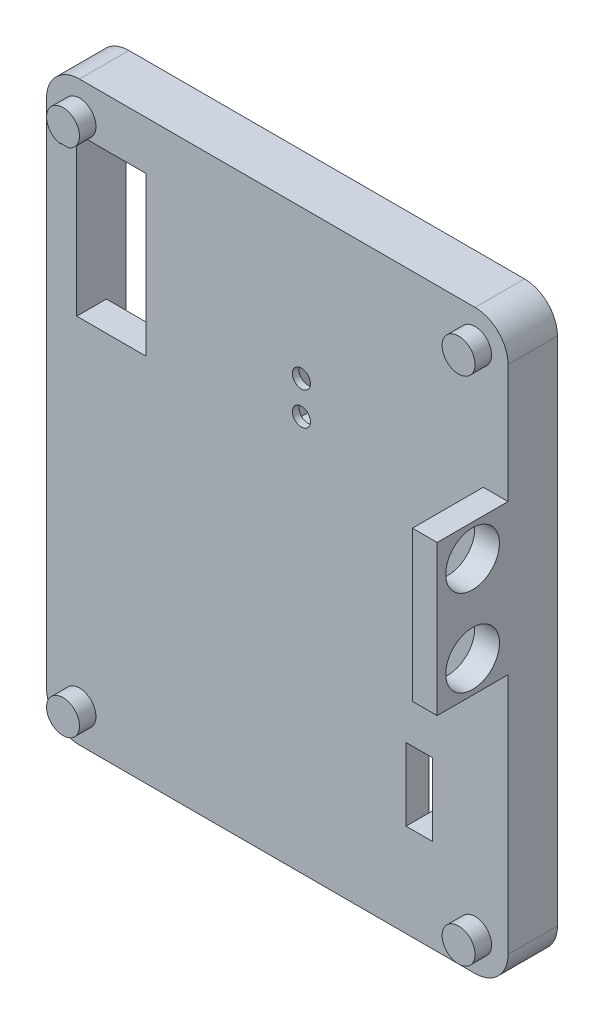
from build123d import *

# Parameters (mm, degrees)
BOSS_EXTRUDE1_DEPTH = 15
SKETCH5_R           = 5
BOSS_EXTRUDE2_DEPTH = 5
SKETCH8_W           = 7.5
SKETCH8_H           = 45.5
CUT_EXTRUDE1_DEPTH  = 7.5
SKETCH9_R           = 8.15
BOSS_EXTRUDE4_DEPTH = 7.5
SKETCH15_W          = 76.4
SKETCH15_H          = 69.2
CUT_EXTRUDE2_DEPTH  = 8
SKETCH16_W          = 5.2
SKETCH16_H          = 22
CUT_EXTRUDE3_DEPTH  = 8
SKETCH20_W          = 8
SKETCH20_H          = 22
CUT_EXTRUDE4_DEPTH  = 10
SKETCH21_W          = 7.307692308
SKETCH21_H          = 1.025641026
CUT_EXTRUDE5_DEPTH  = 3
SKETCH14_W          = 36.6
SKETCH14_H          = 80.6
CUT_EXTRUDE6_DEPTH  = 6
SKETCH22_W          = 21
SKETCH22_H          = 48
CUT_EXTRUDE7_DEPTH  = 15
SKETCH24_W          = 10
SKETCH24_H          = 20
CUT_EXTRUDE8_DEPTH  = 13
SKETCH25_R          = 2.75
CUT_EXTRUDE9_DEPTH  = 10


with BuildPart() as part:
    # Sketch2 → Boss-Extrude1 (new body)
    with BuildSketch(Plane.XY):
        with BuildLine():
            Line((-78.972650771, 68.823281907), (41.027349229, 68.823281907))
            ThreePointArc((41.027349229, 68.823281907), (48.09841704, 65.894349719), (51.027349229, 58.823281907))
            Line((51.027349229, 58.823281907), (51.027349229, -96.176718093))
            ThreePointArc((51.027349229, -96.176718093), (48.09841704, -103.247785904), (41.027349229, -106.176718093))
            Line((41.027349229, -106.176718093), (-78.972650771, -106.176718093))
            ThreePointArc((-78.972650771, -106.176718093), (-86.043718583, -103.247785904), (-88.972650771, -96.176718093))
            Line((-88.972650771, -96.176718093), (-88.972650771, 58.823281907))
            ThreePointArc((-88.972650771, 58.823281907), (-86.043718583, 65.894349719), (-78.972650771, 68.823281907))
        make_face()
    extrude(amount=BOSS_EXTRUDE1_DEPTH)

    # Sketch5 → Boss-Extrude2 (add)
    with BuildSketch(Plane.XY.offset(15)):
        with Locations(Location((-78.972650771, 58.823281907, 0), (0, 0, 180))):
            Circle(SKETCH5_R)
        with Locations(Location((41.027349229, 58.823281907, 0), (0, 0, 180))):
            Circle(SKETCH5_R)
        with Locations(Location((41.027349229, -96.176718093, 0), (0, 0, 180))):
            Circle(SKETCH5_R)
        with Locations(Location((-78.972650771, -96.176718093, 0), (0, 0, 180))):
            Circle(SKETCH5_R)
    extrude(amount=BOSS_EXTRUDE2_DEPTH)

    # Sketch8 → Cut-Extrude1 (cut)
    with BuildSketch(Plane.XY.offset(15)):
        with Locations((47.277349229, 0.073281907)):
            Rectangle(SKETCH8_W, SKETCH8_H)
    extrude(amount=-CUT_EXTRUDE1_DEPTH, mode=Mode.SUBTRACT)

    # Sketch9 → Boss-Extrude4 (add)
    with BuildSketch(Plane(origin=(43.527349229, 0, 0), x_dir=(0, 0, -1), z_dir=(1, 0, 0))):
        Polygon((-15, 22.823281907), (-36.5, 22.823281907), (-36.5, -22.676718093), (-15, -22.676718093), (-7.5, -22.676718093), (-7.5, 22.823281907), align=None)
        with Locations(Location((-25.75, 13.173281907, 0), (0, 0, 90))):
            Circle(SKETCH9_R, mode=Mode.SUBTRACT)
        with Locations(Location((-25.75, -13.026718093, 0), (0, 0, 270))):
            Circle(SKETCH9_R, mode=Mode.SUBTRACT)
    extrude(amount=BOSS_EXTRUDE4_DEPTH)

    # Sketch15 → Cut-Extrude2 (cut)
    with BuildSketch(Plane(origin=(0, 0, 0), x_dir=(-1, 0, 0), z_dir=(0, 0, -1))):
        with Locations((18.114625012, -66.937076593)):
            Rectangle(SKETCH15_W, SKETCH15_H)
    extrude(amount=-CUT_EXTRUDE2_DEPTH, mode=Mode.SUBTRACT)

    # Sketch16 → Cut-Extrude3 (cut)
    with BuildSketch(Plane.ZY.offset(-20.085374988)):
        with Locations((4, -66.937076593)):
            Rectangle(SKETCH16_W, SKETCH16_H)
    extrude(amount=-CUT_EXTRUDE3_DEPTH, mode=Mode.SUBTRACT)

    # Sketch20 → Cut-Extrude4 (cut)
    with BuildSketch(Plane(origin=(0, 0, 6.6), x_dir=(-1, 0, 0), z_dir=(0, 0, -1))):
        with Locations((-24.085374988, -66.937076593)):
            Rectangle(SKETCH20_W, SKETCH20_H)
    extrude(amount=-CUT_EXTRUDE4_DEPTH, mode=Mode.SUBTRACT)

    # Sketch21 → Cut-Extrude5 (cut)
    # profile 1 of 10: a face of its own
    with BuildSketch(Plane(origin=(0, 0, 0), x_dir=(-1, 0, 0), z_dir=(0, 0, -1))):
        Polygon((-18.340898113, 67.541230625), (-18.340898113, 62.156615241), (-19.366539139, 62.156615241), (-19.366539139, 66.5155896), (-22.443462216, 66.5155896), (-22.443462216, 62.156615241), (-23.469103241, 62.156615241), (-23.469103241, 66.5155896), (-28.340898113, 66.5155896), (-28.340898113, 67.541230625), align=None)
    # profile 2 of 10: a face of its own
    with BuildSketch(Plane(origin=(0, 0, 0), x_dir=(-1, 0, 0), z_dir=(0, 0, -1))):
        with BuildLine():
            Line((-26.033205805, 52.87897101), (-26.451875677, 52.0155896))
            add(Edge.make_bspline(
                [(-26.451875677, 52.0155896), (-26.564634126, 52.086540986), (-26.784607929, 52.224955859), (-27.087257087, 52.459332461), (-27.356132613, 52.708864149), (-27.591471838, 52.976221044), (-27.794021747, 53.260689821), (-27.971423557, 53.5610562), (-28.123613624, 53.877992211), (-28.251604018, 54.213140499), (-28.349010844, 54.568823807), (-28.418932766, 54.946029013), (-28.461520765, 55.345271655), (-28.466534958, 55.619248362), (-28.469103241, 55.759579984)],
                knots=[0, 0, 0, 0, 1.072404478, 2.092090602, 3.077524813, 4.022497964, 4.955181213, 5.885738217, 6.828566832, 7.783357951, 8.770975945, 9.794031256, 10.870096747, 12, 12, 12, 12], degree=3))
            add(Edge.make_bspline(
                [(-28.469103241, 55.759579984), (-28.465866358, 55.915331479), (-28.459566333, 56.218474477), (-28.404106526, 56.660294435), (-28.314990347, 57.076390183), (-28.189098296, 57.466829233), (-28.026028307, 57.830433791), (-27.825860798, 58.16732299), (-27.591461417, 58.479743088), (-27.320448765, 58.759723486), (-27.028896398, 59.009919305), (-26.727051925, 59.232415221), (-26.412041651, 59.41709178), (-26.089296787, 59.570322249), (-25.757161582, 59.689478971), (-25.415462088, 59.773254049), (-25.064763678, 59.828082274), (-24.826813462, 59.833417762), (-24.707084011, 59.83610242)],
                knots=[0, 0, 0, 0, 1.205476607, 2.346249014, 3.44140634, 4.495919208, 5.516374937, 6.520047818, 7.524040203, 8.533236858, 9.530256897, 10.496081037, 11.432383234, 12.352807798, 13.258729667, 14.159013654, 15.073670579, 16, 16, 16, 16], degree=3))
            add(Edge.make_bspline(
                [(-24.707084011, 59.83610242), (-24.594748939, 59.833640876), (-24.371867075, 59.828756973), (-24.042806828, 59.782587456), (-23.721952418, 59.71121583), (-23.411171365, 59.608017608), (-23.108715821, 59.478000304), (-22.817806227, 59.315383604), (-22.533106699, 59.128234351), (-22.356648648, 58.981176908), (-22.267180164, 58.906615241)],
                knots=[0, 0, 0, 0, 1.009393624, 2.002718548, 2.981368972, 3.96092115, 4.942292709, 5.936433579, 6.953722102, 8, 8, 8, 8], degree=3))
            add(Edge.make_bspline(
                [(-22.267180164, 58.906615241), (-22.158811352, 58.806645801), (-21.944486525, 58.60893271), (-21.664183451, 58.276684173), (-21.430915021, 57.916030613), (-21.236728954, 57.532518207), (-21.089528457, 57.122192909), (-20.979418934, 56.68928601), (-20.9183064, 56.230074201), (-20.909499296, 55.916000576), (-20.905000677, 55.755573574)],
                knots=[0, 0, 0, 0, 0.996914619, 1.971633233, 2.931517459, 3.89730572, 4.873478647, 5.874999675, 6.914562053, 8, 8, 8, 8], degree=3))
            add(Edge.make_bspline(
                [(-20.905000677, 55.755573574), (-20.908866421, 55.590391907), (-20.916444713, 55.266574501), (-20.986665327, 54.79405791), (-21.098106192, 54.346631997), (-21.254761496, 53.924687172), (-21.458213491, 53.52892987), (-21.709757016, 53.160897053), (-22.001986118, 52.814677608), (-22.228572145, 52.611337508), (-22.343301959, 52.508378061)],
                knots=[0, 0, 0, 0, 1.078642804, 2.114540435, 3.113387415, 4.086610623, 5.048542974, 6.012925659, 6.993862624, 8, 8, 8, 8], degree=3))
            add(Edge.make_bspline(
                [(-22.343301959, 52.508378061), (-22.429561505, 52.439283408), (-22.601171023, 52.301822677), (-22.88047697, 52.124906467), (-23.174797206, 51.974476915), (-23.485635544, 51.851969474), (-23.811447746, 51.755583293), (-24.1532671, 51.686188756), (-24.51088987, 51.640474518), (-24.755018613, 51.634180116), (-24.879359652, 51.630974215)],
                knots=[0, 0, 0, 0, 0.967473567, 1.924745518, 2.889953502, 3.858752097, 4.846970718, 5.862117206, 6.911121386, 8, 8, 8, 8], degree=3))
            Line((-24.879359652, 51.630974215), (-24.879359652, 58.810461395))
            add(Edge.make_bspline(
                [(-24.879359652, 58.810461395), (-24.975656908, 58.805477454), (-25.165179857, 58.795668544), (-25.442872602, 58.752080599), (-25.706242698, 58.679007418), (-25.95599747, 58.582648663), (-26.193278206, 58.461866463), (-26.415333125, 58.312598819), (-26.625359875, 58.138801057), (-26.819909289, 57.942112741), (-26.995102618, 57.725950697), (-27.151180399, 57.497068776), (-27.280718412, 57.254120029), (-27.388372849, 56.999643517), (-27.470338033, 56.732385119), (-27.527688198, 56.451945636), (-27.565093108, 56.159891052), (-27.569456357, 55.960684208), (-27.571667344, 55.859740241)],
                knots=[0, 0, 0, 0, 1.039223247, 2.045298721, 3.023396415, 3.980684843, 4.927328689, 5.887779393, 6.859363718, 7.862265729, 8.865245262, 9.855665766, 10.844541213, 11.828661603, 12.830658759, 13.85293551, 14.912019266, 16, 16, 16, 16], degree=3))
            add(Edge.make_bspline(
                [(-27.571667344, 55.859740241), (-27.56986323, 55.76083343), (-27.566257636, 55.563164245), (-27.533376483, 55.269109648), (-27.47876666, 54.979440532), (-27.405103744, 54.697013128), (-27.314936254, 54.426541124), (-27.205456019, 54.175740078), (-27.086447293, 53.944111666), (-26.947954926, 53.728733458), (-26.780873354, 53.519272501), (-26.56870726, 53.313860089), (-26.320408477, 53.092780285), (-26.132569183, 52.952942508), (-26.033205805, 52.87897101)],
                knots=[0, 0, 0, 0, 1.015773739, 2.030064121, 3.035033926, 4.041594318, 5.026393397, 5.960409026, 6.850153098, 7.698755456, 8.586832174, 9.595703791, 10.728173498, 12, 12, 12, 12], degree=3))
        make_face()
        with BuildLine():
            add(Edge.make_bspline(
                [(-23.981923754, 52.656615241), (-23.862818163, 52.69280777), (-23.633206738, 52.762579626), (-23.315516485, 52.904556165), (-23.032751548, 53.065600488), (-22.788162053, 53.258263639), (-22.572730231, 53.478238482), (-22.381713335, 53.7288631), (-22.213105667, 54.011375456), (-22.069013287, 54.322596421), (-21.948775646, 54.652429932), (-21.865646545, 54.996551171), (-21.810390156, 55.347793959), (-21.805098951, 55.58575736), (-21.802436575, 55.705493446)],
                knots=[0, 0, 0, 0, 1.104265301, 2.128799562, 3.082586596, 3.986305114, 4.883465809, 5.809562452, 6.777505907, 7.798620949, 8.850660173, 9.88882641, 10.937720416, 12, 12, 12, 12], degree=3))
            add(Edge.make_bspline(
                [(-21.802436575, 55.705493446), (-21.804199854, 55.803065815), (-21.807687945, 55.996081899), (-21.84021786, 56.280264048), (-21.894688094, 56.553349269), (-21.968225209, 56.816812396), (-22.067611042, 57.067710051), (-22.183353379, 57.311023251), (-22.324219993, 57.54172078), (-22.432909668, 57.686179538), (-22.487532729, 57.758778702)],
                knots=[0, 0, 0, 0, 1.060590219, 2.098042437, 3.104680641, 4.085971205, 5.067476599, 6.035109478, 7.012525024, 8, 8, 8, 8], degree=3))
            add(Edge.make_bspline(
                [(-22.487532729, 57.758778702), (-22.530610347, 57.810446608), (-22.617576394, 57.914754917), (-22.767949249, 58.055952586), (-22.930145324, 58.191191427), (-23.109077433, 58.316364407), (-23.306481491, 58.426976099), (-23.517194468, 58.530978887), (-23.742037574, 58.629341875), (-23.900643935, 58.68154552), (-23.981923754, 58.708297933)],
                knots=[0, 0, 0, 0, 0.897956368, 1.812814139, 2.750567833, 3.7181851, 4.725099052, 5.770365708, 6.857395943, 8, 8, 8, 8], degree=3))
            Line((-23.981923754, 58.708297933), (-23.981923754, 52.656615241))
        make_face(mode=Mode.SUBTRACT)
    # profile 3 of 10: a face of its own
    with BuildSketch(Plane(origin=(0, 0, 0), x_dir=(-1, 0, 0), z_dir=(0, 0, -1))):
        with BuildLine():
            Line((-21.033205805, 49.182256266), (-21.033205805, 48.156615241))
            Line((-21.033205805, 48.156615241), (-22.108926959, 48.156615241))
            add(Edge.make_bspline(
                [(-22.108926959, 48.156615241), (-22.00869598, 48.083635014), (-21.816340759, 47.943577243), (-21.561394823, 47.712861168), (-21.353860793, 47.472921343), (-21.186148692, 47.228892316), (-21.061497532, 46.977130663), (-20.969504787, 46.722193336), (-20.915922479, 46.460123426), (-20.908647824, 46.283851369), (-20.905000677, 46.19547742)],
                knots=[0, 0, 0, 0, 1.240427292, 2.380528127, 3.432374491, 4.409253451, 5.335797345, 6.23628025, 7.115759577, 8, 8, 8, 8], degree=3))
            add(Edge.make_bspline(
                [(-20.905000677, 46.19547742), (-20.908422587, 46.1271341), (-20.915472206, 45.986337145), (-20.964266444, 45.772832639), (-21.042522255, 45.552656532), (-21.116847094, 45.410067206), (-21.155401318, 45.33610242)],
                knots=[0, 0, 0, 0, 0.906785846, 1.868107758, 2.894132143, 4, 4, 4, 4], degree=3))
            Line((-21.155401318, 45.33610242), (-21.932644908, 45.870958189))
            add(Edge.make_bspline(
                [(-21.932644908, 45.870958189), (-21.913406274, 45.918828562), (-21.876919405, 46.009616717), (-21.833281251, 46.142103033), (-21.80814928, 46.263965118), (-21.804251207, 46.341619434), (-21.802436575, 46.377769087)],
                knots=[0, 0, 0, 0, 1.175706723, 2.229776724, 3.175925307, 4, 4, 4, 4], degree=3))
            add(Edge.make_bspline(
                [(-21.802436575, 46.377769087), (-21.807200811, 46.457085602), (-21.816882108, 46.618262885), (-21.893491564, 46.855632231), (-22.016690467, 47.087087885), (-22.155915626, 47.270117492), (-22.288142465, 47.412773914), (-22.406466084, 47.511950806), (-22.533954255, 47.609331354), (-22.677118484, 47.697301546), (-22.833901409, 47.776622565), (-23.002964885, 47.851175705), (-23.185011867, 47.919049895), (-23.311977165, 47.958261939), (-23.376955805, 47.978329984)],
                knots=[0, 0, 0, 0, 1.183469889, 2.404902206, 3.690315378, 5.087227443, 5.828354254, 6.592432814, 7.39066828, 8.224110304, 9.09876113, 10.014614584, 10.983914132, 12, 12, 12, 12], degree=3))
            add(Edge.make_bspline(
                [(-23.376955805, 47.978329984), (-23.434867714, 47.993194003), (-23.56298901, 48.026078385), (-23.778234676, 48.059863144), (-24.032940241, 48.088882439), (-24.326742531, 48.115635737), (-24.660240091, 48.131795582), (-25.032853462, 48.145722109), (-25.445536665, 48.156736368), (-25.73405256, 48.15665684), (-25.884968626, 48.156615241)],
                knots=[0, 0, 0, 0, 0.569195168, 1.259257812, 2.072569368, 3.011111867, 4.068392788, 5.252157063, 6.562666206, 8, 8, 8, 8], degree=3))
            Line((-25.884968626, 48.156615241), (-28.340898113, 48.156615241))
            Line((-28.340898113, 48.156615241), (-28.340898113, 49.182256266))
            Line((-28.340898113, 49.182256266), (-21.033205805, 49.182256266))
        make_face()
    # profile 4 of 10: a face of its own
    with BuildSketch(Plane(origin=(0, 0, 0), x_dir=(-1, 0, 0), z_dir=(0, 0, -1))):
        with BuildLine():
            Line((-18.084487857, 35.451487036), (-28.340898113, 35.451487036))
            Line((-28.340898113, 35.451487036), (-28.340898113, 36.477128061))
            Line((-28.340898113, 36.477128061), (-27.076875677, 36.477128061))
            add(Edge.make_bspline(
                [(-27.076875677, 36.477128061), (-27.191744538, 36.585426728), (-27.41759117, 36.798355532), (-27.704687513, 37.155934692), (-27.949634078, 37.528807881), (-28.142380704, 37.924455584), (-28.28872562, 38.339683279), (-28.391879274, 38.772827776), (-28.459177343, 39.223418481), (-28.465761459, 39.530435504), (-28.469103241, 39.686262677)],
                knots=[0, 0, 0, 0, 1.048308876, 2.06110713, 3.03987525, 4.008597816, 4.978671892, 5.960494838, 6.964844617, 8, 8, 8, 8], degree=3))
            add(Edge.make_bspline(
                [(-28.469103241, 39.686262677), (-28.465607921, 39.825317244), (-28.458726604, 40.099077169), (-28.40527277, 40.501400659), (-28.319064256, 40.888257277), (-28.19930686, 41.260552846), (-28.04178607, 41.616390874), (-27.850628042, 41.956491609), (-27.62452769, 42.281126219), (-27.366083114, 42.585987173), (-27.08485984, 42.866620359), (-26.785009438, 43.113255198), (-26.468934895, 43.321309801), (-26.13645423, 43.489737727), (-25.790428824, 43.623431645), (-25.428959352, 43.717500279), (-25.052840935, 43.77524119), (-24.796768011, 43.781598978), (-24.667019908, 43.784820369)],
                knots=[0, 0, 0, 0, 1.073073656, 2.112584797, 3.126702685, 4.129122165, 5.126067387, 6.125314918, 7.136179308, 8.17492349, 9.206340236, 10.198905725, 11.166712963, 12.121017021, 13.070562889, 14.024435364, 14.999012625, 16, 16, 16, 16], degree=3))
            add(Edge.make_bspline(
                [(-24.667019908, 43.784820369), (-24.539910008, 43.781788967), (-24.288324269, 43.775788982), (-23.919194717, 43.714947881), (-23.563078651, 43.621024744), (-23.221456524, 43.488518178), (-22.89456655, 43.316588004), (-22.582558307, 43.105974593), (-22.283199714, 42.859242447), (-22.004033035, 42.575770997), (-21.746838111, 42.268314939), (-21.522195015, 41.940638053), (-21.329563965, 41.598932412), (-21.175868365, 41.239552571), (-21.052422179, 40.866669231), (-20.966389199, 40.477434971), (-20.916010971, 40.072876972), (-20.908710051, 39.797916682), (-20.905000677, 39.658217805)],
                knots=[0, 0, 0, 0, 0.982608992, 1.944855656, 2.885902759, 3.827956019, 4.773021323, 5.737262684, 6.73535209, 7.769099895, 8.810832312, 9.832479667, 10.838491863, 11.840357401, 12.851555398, 13.873006831, 14.919340111, 16, 16, 16, 16], degree=3))
            add(Edge.make_bspline(
                [(-20.905000677, 39.658217805), (-20.909457769, 39.497693082), (-20.918196206, 39.182973249), (-20.991736375, 38.722249267), (-21.114639692, 38.285827617), (-21.282640537, 37.87195145), (-21.502221615, 37.484053898), (-21.767622866, 37.119187641), (-22.084802072, 36.780488445), (-22.325057982, 36.579521126), (-22.447468626, 36.477128061)],
                knots=[0, 0, 0, 0, 1.049814683, 2.058234376, 3.043002103, 4.010869613, 4.973269153, 5.951961459, 6.956522166, 8, 8, 8, 8], degree=3))
            Line((-22.447468626, 36.477128061), (-18.084487857, 36.477128061))
            Line((-18.084487857, 36.477128061), (-18.084487857, 35.451487036))
        make_face()
        with BuildLine():
            add(Edge.make_bspline(
                [(-21.802436575, 39.614147292), (-21.807153063, 39.753320452), (-21.816488212, 40.028780144), (-21.887979899, 40.433444775), (-22.00725433, 40.821321545), (-22.171501606, 41.189131514), (-22.375811366, 41.532574102), (-22.625442483, 41.838592007), (-22.909657822, 42.111181119), (-23.231491559, 42.338008002), (-23.574235895, 42.52559343), (-23.932788138, 42.660332832), (-24.301851281, 42.744854416), (-24.551727587, 42.754394945), (-24.677035934, 42.759179343)],
                knots=[0, 0, 0, 0, 1.058612615, 2.095268259, 3.115848219, 4.139396181, 5.15369598, 6.147203972, 7.135553421, 8.14085386, 9.134361852, 10.100734081, 11.047553268, 12, 12, 12, 12], degree=3))
            add(Edge.make_bspline(
                [(-24.677035934, 42.759179343), (-24.801717764, 42.754561957), (-25.051153134, 42.745324528), (-25.419011781, 42.657716117), (-25.779180488, 42.523106651), (-26.124344639, 42.334574273), (-26.448417982, 42.104436868), (-26.736745096, 41.831380563), (-26.988098801, 41.522001508), (-27.195864484, 41.177701087), (-27.365071998, 40.811349771), (-27.482733914, 40.426419081), (-27.558412421, 40.0291126), (-27.56721936, 39.75872208), (-27.571667344, 39.622160113)],
                knots=[0, 0, 0, 0, 0.947601077, 1.895747144, 2.862346927, 3.867447315, 4.880074733, 5.879531414, 6.88042136, 7.904576093, 8.93254454, 9.943653153, 10.96143263, 12, 12, 12, 12], degree=3))
            add(Edge.make_bspline(
                [(-27.571667344, 39.622160113), (-27.566942158, 39.484312416), (-27.557545019, 39.210170003), (-27.484995595, 38.804523164), (-27.366618199, 38.4096877), (-27.201013172, 38.032126267), (-26.996873842, 37.680702643), (-26.755702003, 37.366750184), (-26.478097625, 37.098191121), (-26.170999417, 36.871984905), (-25.834446297, 36.695112622), (-25.47564271, 36.568267577), (-25.095542157, 36.492266495), (-24.835636277, 36.482241213), (-24.7030776, 36.477128061)],
                knots=[0, 0, 0, 0, 1.045010164, 2.078247345, 3.11484244, 4.164859505, 5.197587711, 6.190302802, 7.157275264, 8.117527337, 9.073496492, 10.029733892, 10.995113668, 12, 12, 12, 12], degree=3))
            add(Edge.make_bspline(
                [(-24.7030776, 36.477128061), (-24.602114293, 36.479787477), (-24.403293055, 36.485024511), (-24.110902168, 36.52753248), (-23.832166361, 36.600508161), (-23.564530528, 36.69816861), (-23.312045834, 36.828483623), (-23.069238733, 36.982277021), (-22.842721547, 37.169197348), (-22.629242677, 37.37968224), (-22.437319174, 37.613270433), (-22.265475961, 37.859213668), (-22.122215079, 38.119959395), (-22.006282465, 38.394172053), (-21.91279004, 38.680644595), (-21.850655375, 38.981072456), (-21.80779811, 39.293065729), (-21.804245422, 39.505822416), (-21.802436575, 39.614147292)],
                knots=[0, 0, 0, 0, 1.016259907, 2.001262226, 2.966589164, 3.913193061, 4.863299954, 5.821860828, 6.801502769, 7.814086819, 8.835846776, 9.841016302, 10.830961972, 11.824962852, 12.834865147, 13.859430231, 14.910130822, 16, 16, 16, 16], degree=3))
        make_face(mode=Mode.SUBTRACT)
    # profile 5 of 10: a face of its own
    with BuildSketch(Plane(origin=(0, 0, 0), x_dir=(-1, 0, 0), z_dir=(0, 0, -1))):
        with BuildLine():
            add(Edge.make_bspline(
                [(-17.956282729, 31.852929343), (-17.958748434, 31.792559616), (-17.963526189, 31.675582234), (-18.007589226, 31.506339595), (-18.079854046, 31.351657559), (-18.178405389, 31.214133844), (-18.294147653, 31.096672158), (-18.429268745, 31.01389188), (-18.5752716, 30.959557347), (-18.677625259, 30.954202177), (-18.729519908, 30.951487036)],
                knots=[0, 0, 0, 0, 1.098085862, 2.12774206, 3.161700462, 4.191141079, 5.197541633, 6.142678554, 7.05831364, 8, 8, 8, 8], degree=3))
            add(Edge.make_bspline(
                [(-18.729519908, 30.951487036), (-18.780068937, 30.954276645), (-18.880433063, 30.959815362), (-19.023910111, 31.013870252), (-19.157102685, 31.097343182), (-19.272671737, 31.21405886), (-19.371159327, 31.351677934), (-19.443441384, 31.506334188), (-19.487499834, 31.675583688), (-19.492278231, 31.792560111), (-19.494744267, 31.852929343)],
                knots=[0, 0, 0, 0, 0.92279425, 1.832190281, 2.772419264, 3.784636293, 4.820026544, 5.859960691, 6.89556777, 8, 8, 8, 8], degree=3))
            add(Edge.make_bspline(
                [(-19.494744267, 31.852929343), (-19.492123201, 31.911925773), (-19.486988896, 32.027491591), (-19.444380617, 32.194635898), (-19.369945628, 32.34691749), (-19.272805855, 32.483849296), (-19.157069876, 32.600487446), (-19.023918272, 32.683979405), (-18.880431017, 32.738029554), (-18.780068251, 32.743568902), (-18.729519908, 32.746358831)],
                knots=[0, 0, 0, 0, 1.086353919, 2.128016574, 3.151788985, 4.193233544, 5.211369379, 6.157096227, 7.071809831, 8, 8, 8, 8], degree=3))
            add(Edge.make_bspline(
                [(-18.729519908, 32.746358831), (-18.677625971, 32.743643359), (-18.575273718, 32.738287537), (-18.429260439, 32.683957842), (-18.29418084, 32.601158304), (-18.178271361, 32.483774233), (-18.081068052, 32.346937392), (-18.006649967, 32.194630534), (-17.96403715, 32.02749301), (-17.958903474, 31.911926252), (-17.956282729, 31.852929343)],
                knots=[0, 0, 0, 0, 0.947160922, 1.868119119, 2.818750662, 3.831001999, 4.866427343, 5.884282678, 6.919924858, 8, 8, 8, 8], degree=3))
        make_face()
    # profile 6 of 10: a face of its own
    with BuildSketch(Plane(origin=(0, 0, 0), x_dir=(-1, 0, 0), z_dir=(0, 0, -1))):
        with Locations((-24.687051959, 31.848922933)):
            Rectangle(SKETCH21_W, SKETCH21_H)
    # profile 7 of 10: a face of its own
    with BuildSketch(Plane(origin=(0, 0, 0), x_dir=(-1, 0, 0), z_dir=(0, 0, -1))):
        with BuildLine():
            Line((-21.033205805, 28.246358831), (-21.033205805, 27.220717805))
            Line((-21.033205805, 27.220717805), (-22.35131478, 27.220717805))
            add(Edge.make_bspline(
                [(-22.35131478, 27.220717805), (-22.231475708, 27.121081027), (-21.997832974, 26.926825441), (-21.695089673, 26.600918132), (-21.442498993, 26.259390983), (-21.243170706, 25.900600071), (-21.091783388, 25.525286364), (-20.983562503, 25.135647538), (-20.917598461, 24.728964242), (-20.9092454, 24.452535172), (-20.905000677, 24.312063959)],
                knots=[0, 0, 0, 0, 1.108672202, 2.161508772, 3.15801219, 4.126310423, 5.075335646, 6.032683419, 7.000281171, 8, 8, 8, 8], degree=3))
            add(Edge.make_bspline(
                [(-20.905000677, 24.312063959), (-20.909999269, 24.170841268), (-20.91978827, 23.89427756), (-20.996878957, 23.491082349), (-21.128695657, 23.11332542), (-21.30816469, 22.762895065), (-21.532573954, 22.448020473), (-21.795329457, 22.173862737), (-22.0956356, 21.945591511), (-22.374743949, 21.791069755), (-22.62376794, 21.693040704), (-22.835105664, 21.627071518), (-23.071956178, 21.574485783), (-23.331683397, 21.527445521), (-23.616896665, 21.495693242), (-23.926031294, 21.468206763), (-24.259607028, 21.455927375), (-24.490065891, 21.452997924), (-24.608926959, 21.451487036)],
                knots=[0, 0, 0, 0, 1.266590423, 2.480429605, 3.666582892, 4.845617996, 6.001095853, 7.123990959, 8.23963778, 9.373856591, 9.973539313, 10.638696804, 11.358118503, 12.1491017, 13.005961033, 13.931924058, 14.933372694, 16, 16, 16, 16], degree=3))
            Line((-24.608926959, 21.451487036), (-28.340898113, 21.451487036))
            Line((-28.340898113, 21.451487036), (-28.340898113, 22.477128061))
            Line((-28.340898113, 22.477128061), (-24.903398113, 22.477128061))
            add(Edge.make_bspline(
                [(-24.903398113, 22.477128061), (-24.803902601, 22.476715906), (-24.613582573, 22.475927515), (-24.341164813, 22.481275784), (-24.094080567, 22.484511443), (-23.873018977, 22.490094175), (-23.67810702, 22.499070286), (-23.508968324, 22.50536461), (-23.366143609, 22.517896361), (-23.279454451, 22.527102852), (-23.240737857, 22.5312146)],
                knots=[0, 0, 0, 0, 1.434747502, 2.74445729, 3.92900273, 4.998231774, 5.933055848, 6.742823335, 7.438527271, 8, 8, 8, 8], degree=3))
            add(Edge.make_bspline(
                [(-23.240737857, 22.5312146), (-23.182456533, 22.539545526), (-23.068993583, 22.555764296), (-22.90616308, 22.596407869), (-22.753198218, 22.648291426), (-22.612175207, 22.715895402), (-22.482558476, 22.797449079), (-22.363041659, 22.889311257), (-22.256268263, 22.997116365), (-22.127432863, 23.158696442), (-21.993545683, 23.39116984), (-21.882439265, 23.706926363), (-21.81297407, 24.059319168), (-21.806048873, 24.307044827), (-21.802436575, 24.436262677)],
                knots=[0, 0, 0, 0, 0.798412103, 1.554360583, 2.273579532, 2.986838317, 3.670657645, 4.348508324, 5.027629462, 5.723822308, 7.14887163, 8.642110407, 10.248468588, 12, 12, 12, 12], degree=3))
            add(Edge.make_bspline(
                [(-21.802436575, 24.436262677), (-21.803782513, 24.513125111), (-21.806435663, 24.664638429), (-21.833407303, 24.889161657), (-21.87805894, 25.107173411), (-21.936421086, 25.320702645), (-22.019128444, 25.524762752), (-22.112502321, 25.72577826), (-22.227177332, 25.91867362), (-22.357013762, 26.104879693), (-22.500053063, 26.278706751), (-22.651147817, 26.440805499), (-22.810471779, 26.587208294), (-22.980536075, 26.715581592), (-23.156657565, 26.830565674), (-23.342219298, 26.929298767), (-23.536040361, 27.011689776), (-23.670369616, 27.053552794), (-23.737532729, 27.074483831)],
                knots=[0, 0, 0, 0, 1.05189985, 2.073533572, 3.09004218, 4.09709392, 5.098653972, 6.100464298, 7.128945945, 8.166165635, 9.205558359, 10.207994101, 11.198015298, 12.163377701, 13.121833555, 14.07469305, 15.037368227, 16, 16, 16, 16], degree=3))
            add(Edge.make_bspline(
                [(-23.737532729, 27.074483831), (-23.786826655, 27.086390154), (-23.894076215, 27.112294927), (-24.070076671, 27.141418653), (-24.274163745, 27.164103834), (-24.50508727, 27.186905978), (-24.764342553, 27.202493673), (-25.050937941, 27.210933914), (-25.365412298, 27.220487346), (-25.584478866, 27.220638838), (-25.698670549, 27.220717805)],
                knots=[0, 0, 0, 0, 0.617412555, 1.343314088, 2.170381765, 3.117878472, 4.168869578, 5.332398411, 6.609473285, 8, 8, 8, 8], degree=3))
            Line((-25.698670549, 27.220717805), (-28.340898113, 27.220717805))
            Line((-28.340898113, 27.220717805), (-28.340898113, 28.246358831))
            Line((-28.340898113, 28.246358831), (-21.033205805, 28.246358831))
        make_face()
    # profile 8 of 10: a face of its own
    with BuildSketch(Plane(origin=(0, 0, 0), x_dir=(-1, 0, 0), z_dir=(0, 0, -1))):
        with BuildLine():
            Line((-21.033205805, 10.156615241), (-28.340898113, 10.156615241))
            Line((-28.340898113, 10.156615241), (-28.340898113, 11.182256266))
            Line((-28.340898113, 11.182256266), (-27.076875677, 11.182256266))
            add(Edge.make_bspline(
                [(-27.076875677, 11.182256266), (-27.191744538, 11.290554934), (-27.41759117, 11.503483737), (-27.704687513, 11.861062897), (-27.949634078, 12.233936087), (-28.142380704, 12.629583789), (-28.28872562, 13.044811484), (-28.391879274, 13.477955981), (-28.459177343, 13.928546686), (-28.465761459, 14.235563709), (-28.469103241, 14.391390882)],
                knots=[0, 0, 0, 0, 1.048308876, 2.06110713, 3.03987525, 4.008597816, 4.978671892, 5.960494838, 6.964844617, 8, 8, 8, 8], degree=3))
            add(Edge.make_bspline(
                [(-28.469103241, 14.391390882), (-28.465607921, 14.530445449), (-28.458726604, 14.804205374), (-28.40527277, 15.206528864), (-28.319064256, 15.593385482), (-28.19930686, 15.965681052), (-28.04178607, 16.321519079), (-27.850628042, 16.661619814), (-27.62452769, 16.986254424), (-27.366083114, 17.291115378), (-27.08485984, 17.571748564), (-26.785009438, 17.818383403), (-26.468934895, 18.026438006), (-26.13645423, 18.194865932), (-25.790428824, 18.32855985), (-25.428959352, 18.422628484), (-25.052840935, 18.480369395), (-24.796768011, 18.486727183), (-24.667019908, 18.489948574)],
                knots=[0, 0, 0, 0, 1.073073656, 2.112584797, 3.126702685, 4.129122165, 5.126067387, 6.125314918, 7.136179308, 8.17492349, 9.206340236, 10.198905725, 11.166712963, 12.121017021, 13.070562889, 14.024435364, 14.999012625, 16, 16, 16, 16], degree=3))
            add(Edge.make_bspline(
                [(-24.667019908, 18.489948574), (-24.539910008, 18.486917172), (-24.288324269, 18.480917187), (-23.919194717, 18.420076086), (-23.563078651, 18.326152949), (-23.221456524, 18.193646383), (-22.89456655, 18.021716209), (-22.582558307, 17.811102798), (-22.283199714, 17.564370652), (-22.004033035, 17.280899202), (-21.746838111, 16.973443144), (-21.522195015, 16.645766259), (-21.329563965, 16.304060617), (-21.175868365, 15.944680776), (-21.052422179, 15.571797436), (-20.966389199, 15.182563176), (-20.916010971, 14.778005177), (-20.908710051, 14.503044887), (-20.905000677, 14.36334601)],
                knots=[0, 0, 0, 0, 0.982608992, 1.944855656, 2.885902759, 3.827956019, 4.773021323, 5.737262684, 6.73535209, 7.769099895, 8.810832312, 9.832479667, 10.838491863, 11.840357401, 12.851555398, 13.873006831, 14.919340111, 16, 16, 16, 16], degree=3))
            add(Edge.make_bspline(
                [(-20.905000677, 14.36334601), (-20.909090608, 14.202866658), (-20.917102341, 13.888504868), (-20.984246008, 13.428234967), (-21.097144554, 12.992220586), (-21.250400754, 12.577992484), (-21.455066261, 12.187886788), (-21.713812284, 11.825024294), (-22.022806258, 11.483228625), (-22.26252271, 11.284234177), (-22.385369267, 11.182256266)],
                knots=[0, 0, 0, 0, 1.05696385, 2.070478496, 3.056424618, 4.019822373, 4.97424833, 5.949536329, 6.949206861, 8, 8, 8, 8], degree=3))
            Line((-22.385369267, 11.182256266), (-21.033205805, 11.182256266))
            Line((-21.033205805, 11.182256266), (-21.033205805, 10.156615241))
        make_face()
        with BuildLine():
            add(Edge.make_bspline(
                [(-21.802436575, 14.319275497), (-21.807153063, 14.458448657), (-21.816488212, 14.733908349), (-21.887979899, 15.138572981), (-22.00725433, 15.52644975), (-22.171501606, 15.894259719), (-22.375811366, 16.237702307), (-22.625442483, 16.543720212), (-22.909657822, 16.816309324), (-23.231491559, 17.043136207), (-23.574235895, 17.230721635), (-23.932788138, 17.365461037), (-24.301851281, 17.449982621), (-24.551727587, 17.45952315), (-24.677035934, 17.464307548)],
                knots=[0, 0, 0, 0, 1.058612615, 2.095268259, 3.115848219, 4.139396181, 5.15369598, 6.147203972, 7.135553421, 8.14085386, 9.134361852, 10.100734081, 11.047553268, 12, 12, 12, 12], degree=3))
            add(Edge.make_bspline(
                [(-24.677035934, 17.464307548), (-24.801717764, 17.459690162), (-25.051153134, 17.450452733), (-25.419011781, 17.362844322), (-25.779180488, 17.228234857), (-26.124344639, 17.039702478), (-26.448417982, 16.809565073), (-26.736745096, 16.536508768), (-26.988098801, 16.227129713), (-27.195864484, 15.882829292), (-27.365071998, 15.516477976), (-27.482733914, 15.131547286), (-27.558412421, 14.734240805), (-27.56721936, 14.463850285), (-27.571667344, 14.327288318)],
                knots=[0, 0, 0, 0, 0.947601077, 1.895747144, 2.862346927, 3.867447315, 4.880074733, 5.879531414, 6.88042136, 7.904576093, 8.93254454, 9.943653153, 10.96143263, 12, 12, 12, 12], degree=3))
            add(Edge.make_bspline(
                [(-27.571667344, 14.327288318), (-27.566942158, 14.189440622), (-27.557545019, 13.915298208), (-27.484995595, 13.509651369), (-27.366618199, 13.114815905), (-27.201013172, 12.737254472), (-26.996873842, 12.385830848), (-26.755702003, 12.071878389), (-26.478097625, 11.803319326), (-26.170999417, 11.57711311), (-25.834446297, 11.400240827), (-25.47564271, 11.273395783), (-25.095542157, 11.1973947), (-24.835636277, 11.187369418), (-24.7030776, 11.182256266)],
                knots=[0, 0, 0, 0, 1.045010164, 2.078247345, 3.11484244, 4.164859505, 5.197587711, 6.190302802, 7.157275264, 8.117527337, 9.073496492, 10.029733892, 10.995113668, 12, 12, 12, 12], degree=3))
            add(Edge.make_bspline(
                [(-24.7030776, 11.182256266), (-24.602114293, 11.184915682), (-24.403293055, 11.190152716), (-24.110902168, 11.232660686), (-23.832166361, 11.305636366), (-23.564530528, 11.403296815), (-23.312045834, 11.533611829), (-23.069238733, 11.687405226), (-22.842721547, 11.874325553), (-22.629242677, 12.084810445), (-22.437319174, 12.318398638), (-22.265475961, 12.564341873), (-22.122215079, 12.825087601), (-22.006282465, 13.099300258), (-21.91279004, 13.3857728), (-21.850655375, 13.686200661), (-21.80779811, 13.998193934), (-21.804245422, 14.210950621), (-21.802436575, 14.319275497)],
                knots=[0, 0, 0, 0, 1.016259907, 2.001262226, 2.966589164, 3.913193061, 4.863299954, 5.821860828, 6.801502769, 7.814086819, 8.835846776, 9.841016302, 10.830961972, 11.824962852, 12.834865147, 13.859430231, 14.910130822, 16, 16, 16, 16], degree=3))
        make_face(mode=Mode.SUBTRACT)
    # profile 9 of 10: a face of its own
    with BuildSketch(Plane(origin=(0, 0, 0), x_dir=(-1, 0, 0), z_dir=(0, 0, -1))):
        with BuildLine():
            Line((-21.033205805, 6.938666523), (-21.033205805, 5.913025497))
            Line((-21.033205805, 5.913025497), (-22.35131478, 5.913025497))
            add(Edge.make_bspline(
                [(-22.35131478, 5.913025497), (-22.231475708, 5.813388719), (-21.997832974, 5.619133133), (-21.695089673, 5.293225824), (-21.442498993, 4.951698675), (-21.243170706, 4.592907763), (-21.091783388, 4.217594057), (-20.983562503, 3.827955231), (-20.917598461, 3.421271934), (-20.9092454, 3.144842864), (-20.905000677, 3.004371651)],
                knots=[0, 0, 0, 0, 1.108672202, 2.161508772, 3.15801219, 4.126310423, 5.075335646, 6.032683419, 7.000281171, 8, 8, 8, 8], degree=3))
            add(Edge.make_bspline(
                [(-20.905000677, 3.004371651), (-20.909999269, 2.86314896), (-20.91978827, 2.586585253), (-20.996878957, 2.183390042), (-21.128695657, 1.805633112), (-21.30816469, 1.455202758), (-21.532573954, 1.140328165), (-21.795329457, 0.866170429), (-22.0956356, 0.637899204), (-22.374743949, 0.483377447), (-22.62376794, 0.385348396), (-22.835105664, 0.31937921), (-23.071956178, 0.266793475), (-23.331683397, 0.219753213), (-23.616896665, 0.188000934), (-23.926031294, 0.160514456), (-24.259607028, 0.148235067), (-24.490065891, 0.145305616), (-24.608926959, 0.143794728)],
                knots=[0, 0, 0, 0, 1.266590423, 2.480429605, 3.666582892, 4.845617996, 6.001095853, 7.123990959, 8.23963778, 9.373856591, 9.973539313, 10.638696804, 11.358118503, 12.1491017, 13.005961033, 13.931924058, 14.933372694, 16, 16, 16, 16], degree=3))
            Line((-24.608926959, 0.143794728), (-28.340898113, 0.143794728))
            Line((-28.340898113, 0.143794728), (-28.340898113, 1.169435754))
            Line((-28.340898113, 1.169435754), (-24.903398113, 1.169435754))
            add(Edge.make_bspline(
                [(-24.903398113, 1.169435754), (-24.803902601, 1.169023598), (-24.613582573, 1.168235207), (-24.341164813, 1.173583476), (-24.094080567, 1.176819135), (-23.873018977, 1.182401867), (-23.67810702, 1.191377979), (-23.508968324, 1.197672302), (-23.366143609, 1.210204054), (-23.279454451, 1.219410544), (-23.240737857, 1.223522292)],
                knots=[0, 0, 0, 0, 1.434747502, 2.74445729, 3.92900273, 4.998231774, 5.933055848, 6.742823335, 7.438527271, 8, 8, 8, 8], degree=3))
            add(Edge.make_bspline(
                [(-23.240737857, 1.223522292), (-23.182456533, 1.231853218), (-23.068993583, 1.248071988), (-22.90616308, 1.288715561), (-22.753198218, 1.340599118), (-22.612175207, 1.408203095), (-22.482558476, 1.489756771), (-22.363041659, 1.581618949), (-22.256268263, 1.689424057), (-22.127432863, 1.851004134), (-21.993545683, 2.083477532), (-21.882439265, 2.399234055), (-21.81297407, 2.75162686), (-21.806048873, 2.999352519), (-21.802436575, 3.128570369)],
                knots=[0, 0, 0, 0, 0.798412103, 1.554360583, 2.273579532, 2.986838317, 3.670657645, 4.348508324, 5.027629462, 5.723822308, 7.14887163, 8.642110407, 10.248468588, 12, 12, 12, 12], degree=3))
            add(Edge.make_bspline(
                [(-21.802436575, 3.128570369), (-21.803782513, 3.205432803), (-21.806435663, 3.356946121), (-21.833407303, 3.58146935), (-21.87805894, 3.799481103), (-21.936421086, 4.013010338), (-22.019128444, 4.217070444), (-22.112502321, 4.418085952), (-22.227177332, 4.610981312), (-22.357013762, 4.797187385), (-22.500053063, 4.971014443), (-22.651147817, 5.133113192), (-22.810471779, 5.279515986), (-22.980536075, 5.407889284), (-23.156657565, 5.522873367), (-23.342219298, 5.621606459), (-23.536040361, 5.703997468), (-23.670369616, 5.745860486), (-23.737532729, 5.766791523)],
                knots=[0, 0, 0, 0, 1.05189985, 2.073533572, 3.09004218, 4.09709392, 5.098653972, 6.100464298, 7.128945945, 8.166165635, 9.205558359, 10.207994101, 11.198015298, 12.163377701, 13.121833555, 14.07469305, 15.037368227, 16, 16, 16, 16], degree=3))
            add(Edge.make_bspline(
                [(-23.737532729, 5.766791523), (-23.786826655, 5.778697846), (-23.894076215, 5.80460262), (-24.070076671, 5.833726345), (-24.274163745, 5.856411527), (-24.50508727, 5.87921367), (-24.764342553, 5.894801365), (-25.050937941, 5.903241607), (-25.365412298, 5.912795038), (-25.584478866, 5.91294653), (-25.698670549, 5.913025497)],
                knots=[0, 0, 0, 0, 0.617412555, 1.343314088, 2.170381765, 3.117878472, 4.168869578, 5.332398411, 6.609473285, 8, 8, 8, 8], degree=3))
            Line((-25.698670549, 5.913025497), (-28.340898113, 5.913025497))
            Line((-28.340898113, 5.913025497), (-28.340898113, 6.938666523))
            Line((-28.340898113, 6.938666523), (-21.033205805, 6.938666523))
        make_face()
    # profile 10 of 10: a face of its own
    with BuildSketch(Plane(origin=(0, 0, 0), x_dir=(-1, 0, 0), z_dir=(0, 0, -1))):
        with BuildLine():
            Line((-18.084487857, -11.151077067), (-28.340898113, -11.151077067))
            Line((-28.340898113, -11.151077067), (-28.340898113, -10.125436041))
            Line((-28.340898113, -10.125436041), (-27.076875677, -10.125436041))
            add(Edge.make_bspline(
                [(-27.076875677, -10.125436041), (-27.191744538, -10.017137374), (-27.41759117, -9.80420857), (-27.704687513, -9.446629411), (-27.949634078, -9.073756221), (-28.142380704, -8.678108518), (-28.28872562, -8.262880824), (-28.391879274, -7.829736327), (-28.459177343, -7.379145622), (-28.465761459, -7.072128599), (-28.469103241, -6.916301426)],
                knots=[0, 0, 0, 0, 1.048308876, 2.06110713, 3.03987525, 4.008597816, 4.978671892, 5.960494838, 6.964844617, 8, 8, 8, 8], degree=3))
            add(Edge.make_bspline(
                [(-28.469103241, -6.916301426), (-28.465607921, -6.777246859), (-28.458726604, -6.503486933), (-28.40527277, -6.101163443), (-28.319064256, -5.714306826), (-28.19930686, -5.342011256), (-28.04178607, -4.986173229), (-27.850628042, -4.646072494), (-27.62452769, -4.321437883), (-27.366083114, -4.01657693), (-27.08485984, -3.735943743), (-26.785009438, -3.489308905), (-26.468934895, -3.281254301), (-26.13645423, -3.112826375), (-25.790428824, -2.979132458), (-25.428959352, -2.885063824), (-25.052840935, -2.827322913), (-24.796768011, -2.820965124), (-24.667019908, -2.817743734)],
                knots=[0, 0, 0, 0, 1.073073656, 2.112584797, 3.126702685, 4.129122165, 5.126067387, 6.125314918, 7.136179308, 8.17492349, 9.206340236, 10.198905725, 11.166712963, 12.121017021, 13.070562889, 14.024435364, 14.999012625, 16, 16, 16, 16], degree=3))
            add(Edge.make_bspline(
                [(-24.667019908, -2.817743734), (-24.539910008, -2.820775135), (-24.288324269, -2.82677512), (-23.919194717, -2.887616222), (-23.563078651, -2.981539359), (-23.221456524, -3.114045924), (-22.89456655, -3.285976098), (-22.582558307, -3.496589509), (-22.283199714, -3.743321655), (-22.004033035, -4.026793105), (-21.746838111, -4.334249164), (-21.522195015, -4.661926049), (-21.329563965, -5.003631691), (-21.175868365, -5.363011532), (-21.052422179, -5.735894872), (-20.966389199, -6.125129131), (-20.916010971, -6.529687131), (-20.908710051, -6.804647421), (-20.905000677, -6.944346298)],
                knots=[0, 0, 0, 0, 0.982608992, 1.944855656, 2.885902759, 3.827956019, 4.773021323, 5.737262684, 6.73535209, 7.769099895, 8.810832312, 9.832479667, 10.838491863, 11.840357401, 12.851555398, 13.873006831, 14.919340111, 16, 16, 16, 16], degree=3))
            add(Edge.make_bspline(
                [(-20.905000677, -6.944346298), (-20.909457769, -7.10487102), (-20.918196206, -7.419590854), (-20.991736375, -7.880314836), (-21.114639692, -8.316736485), (-21.282640537, -8.730612653), (-21.502221615, -9.118510204), (-21.767622866, -9.483376461), (-22.084802072, -9.822075657), (-22.325057982, -10.023042976), (-22.447468626, -10.125436041)],
                knots=[0, 0, 0, 0, 1.049814683, 2.058234376, 3.043002103, 4.010869613, 4.973269153, 5.951961459, 6.956522166, 8, 8, 8, 8], degree=3))
            Line((-22.447468626, -10.125436041), (-18.084487857, -10.125436041))
            Line((-18.084487857, -10.125436041), (-18.084487857, -11.151077067))
        make_face()
        with BuildLine():
            add(Edge.make_bspline(
                [(-21.802436575, -6.988416811), (-21.807153063, -6.849243651), (-21.816488212, -6.573783959), (-21.887979899, -6.169119327), (-22.00725433, -5.781242558), (-22.171501606, -5.413432588), (-22.375811366, -5.069990001), (-22.625442483, -4.763972095), (-22.909657822, -4.491382984), (-23.231491559, -4.264556101), (-23.574235895, -4.076970672), (-23.932788138, -3.94223127), (-24.301851281, -3.857709686), (-24.551727587, -3.848169158), (-24.677035934, -3.843384759)],
                knots=[0, 0, 0, 0, 1.058612615, 2.095268259, 3.115848219, 4.139396181, 5.15369598, 6.147203972, 7.135553421, 8.14085386, 9.134361852, 10.100734081, 11.047553268, 12, 12, 12, 12], degree=3))
            add(Edge.make_bspline(
                [(-24.677035934, -3.843384759), (-24.801717764, -3.848002146), (-25.051153134, -3.857239574), (-25.419011781, -3.944847985), (-25.779180488, -4.079457451), (-26.124344639, -4.26798983), (-26.448417982, -4.498127235), (-26.736745096, -4.77118354), (-26.988098801, -5.080562595), (-27.195864484, -5.424863015), (-27.365071998, -5.791214332), (-27.482733914, -6.176145022), (-27.558412421, -6.573451503), (-27.56721936, -6.843842023), (-27.571667344, -6.98040399)],
                knots=[0, 0, 0, 0, 0.947601077, 1.895747144, 2.862346927, 3.867447315, 4.880074733, 5.879531414, 6.88042136, 7.904576093, 8.93254454, 9.943653153, 10.96143263, 12, 12, 12, 12], degree=3))
            add(Edge.make_bspline(
                [(-27.571667344, -6.98040399), (-27.566942158, -7.118251686), (-27.557545019, -7.3923941), (-27.484995595, -7.798040938), (-27.366618199, -8.192876403), (-27.201013172, -8.570437836), (-26.996873842, -8.92186146), (-26.755702003, -9.235813919), (-26.478097625, -9.504372981), (-26.170999417, -9.730579198), (-25.834446297, -9.90745148), (-25.47564271, -10.034296525), (-25.095542157, -10.110297608), (-24.835636277, -10.12032289), (-24.7030776, -10.125436041)],
                knots=[0, 0, 0, 0, 1.045010164, 2.078247345, 3.11484244, 4.164859505, 5.197587711, 6.190302802, 7.157275264, 8.117527337, 9.073496492, 10.029733892, 10.995113668, 12, 12, 12, 12], degree=3))
            add(Edge.make_bspline(
                [(-24.7030776, -10.125436041), (-24.602114293, -10.122776626), (-24.403293055, -10.117539591), (-24.110902168, -10.075031622), (-23.832166361, -10.002055942), (-23.564530528, -9.904395493), (-23.312045834, -9.774080479), (-23.069238733, -9.620287081), (-22.842721547, -9.433366755), (-22.629242677, -9.222881862), (-22.437319174, -8.989293669), (-22.265475961, -8.743350435), (-22.122215079, -8.482604707), (-22.006282465, -8.20839205), (-21.91279004, -7.921919508), (-21.850655375, -7.621491646), (-21.80779811, -7.309498373), (-21.804245422, -7.096741687), (-21.802436575, -6.988416811)],
                knots=[0, 0, 0, 0, 1.016259907, 2.001262226, 2.966589164, 3.913193061, 4.863299954, 5.821860828, 6.801502769, 7.814086819, 8.835846776, 9.841016302, 10.830961972, 11.824962852, 12.834865147, 13.859430231, 14.910130822, 16, 16, 16, 16], degree=3))
        make_face(mode=Mode.SUBTRACT)
    extrude(amount=-CUT_EXTRUDE5_DEPTH, mode=Mode.SUBTRACT)

    # Sketch14 → Cut-Extrude6 (cut)
    with BuildSketch(Plane(origin=(0, 0, 0), x_dir=(-1, 0, 0), z_dir=(0, 0, -1))):
        with Locations((61.515509393, 18.797872422)):
            Rectangle(SKETCH14_W, SKETCH14_H)
    extrude(amount=-CUT_EXTRUDE6_DEPTH, mode=Mode.SUBTRACT)

    # Sketch22 → Cut-Extrude7 (cut)
    with BuildSketch(Plane(origin=(0, 0, 6), x_dir=(-1, 0, 0), z_dir=(0, 0, -1))):
        with Locations((69.315509393, 30.097872422)):
            Rectangle(SKETCH22_W, SKETCH22_H)
    extrude(amount=-CUT_EXTRUDE7_DEPTH, mode=Mode.SUBTRACT)

    # Sketch24 → Cut-Extrude8 (cut)
    with BuildSketch(Plane(origin=(0, 0, 0), x_dir=(-1, 0, 0), z_dir=(0, 0, -1))):
        with Locations((11.65731176, 18.797872422)):
            Rectangle(SKETCH24_W, SKETCH24_H)
    extrude(amount=-CUT_EXTRUDE8_DEPTH, mode=Mode.SUBTRACT)

    # Sketch25 → Cut-Extrude9 (cut)
    with BuildSketch(Plane(origin=(0, 0, 13), x_dir=(-1, 0, 0), z_dir=(0, 0, -1))):
        with Locations((11.65731176, 23.797872422)):
            Circle(SKETCH25_R)
        with Locations((11.65731176, 13.797872422)):
            Circle(SKETCH25_R)
    extrude(amount=-CUT_EXTRUDE9_DEPTH, mode=Mode.SUBTRACT)


solid = part.part
